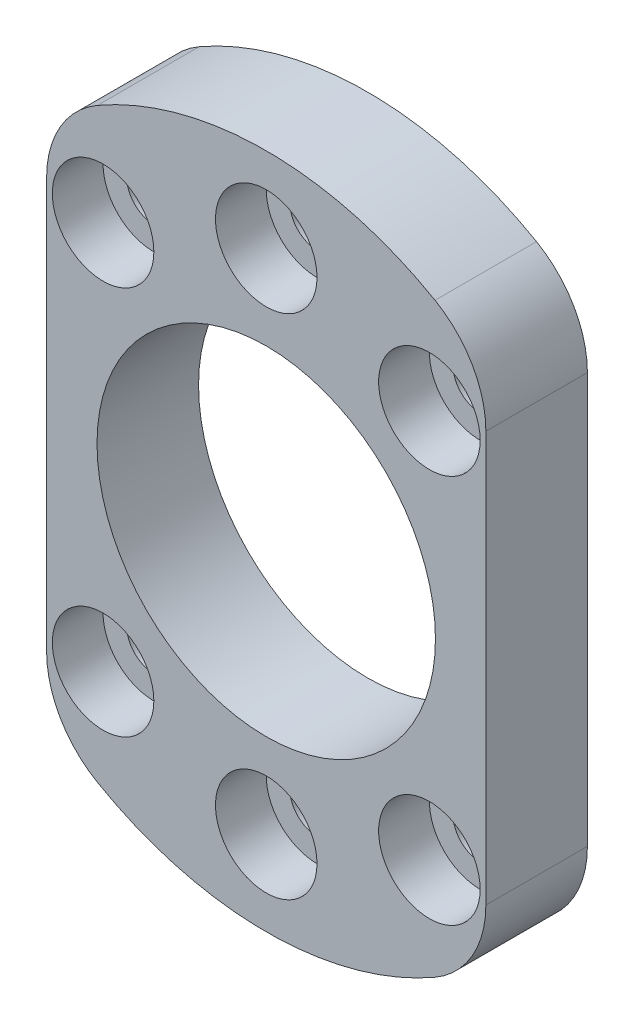
from build123d import *

# Parameters (mm, degrees)
SKETCH_1_R          = 10
EXTRUDE_1_DEPTH     = 6
SKETCH_2_R          = 1.6
CUT_EXTRUDE_1_DEPTH = 7
FILLET_1_R          = 6
FILLET_2_R          = 6
FILLET_3_R          = 6
FILLET_4_R          = 6
SKETCH_3_R          = 3
CUT_EXTRUDE_2_DEPTH = 3


with BuildPart() as part:
    # 草图1 → 拉伸1 (new body)
    with BuildSketch(Plane.XY):
        with BuildLine():
            Line((-12.98, 15.202621484), (-12.98, -15.202621484))
            ThreePointArc((-12.98, -15.202621484), (0, -19.99), (12.98, -15.202621484))
            Line((12.98, -15.202621484), (12.98, 15.202621484))
            ThreePointArc((12.98, 15.202621484), (0, 19.99), (-12.98, 15.202621484))
        make_face()
        Circle(SKETCH_1_R, mode=Mode.SUBTRACT)
    extrude(amount=EXTRUDE_1_DEPTH)

    # 草图2 → 切除-拉伸1 (cut)
    with BuildSketch(Plane.XY.offset(6)):
        with Locations((-9.641814145, 11.490666647)):
            Circle(SKETCH_2_R)
        with Locations((0, 15)):
            Circle(SKETCH_2_R)
        with Locations((9.641814145, 11.490666647)):
            Circle(SKETCH_2_R)
        with Locations((-9.641814145, -11.490666647)):
            Circle(SKETCH_2_R)
        with Locations((0, -15)):
            Circle(SKETCH_2_R)
        with Locations((9.641814145, -11.490666647)):
            Circle(SKETCH_2_R)
    extrude(amount=-CUT_EXTRUDE_1_DEPTH, mode=Mode.SUBTRACT)

    # 圆角1
    fillet_1_edges = [part.edges().sort_by_distance(p)[0] for p in [
        (-12.98, 15.202621484, 3),
    ]]
    fillet(fillet_1_edges, radius=FILLET_1_R)

    # 圆角2
    fillet_2_edges = [part.edges().sort_by_distance(p)[0] for p in [
        (12.98, 15.202621484, 3),
    ]]
    fillet(fillet_2_edges, radius=FILLET_2_R)

    # 圆角3
    fillet_3_edges = [part.edges().sort_by_distance(p)[0] for p in [
        (-12.98, -15.202621484, 3),
    ]]
    fillet(fillet_3_edges, radius=FILLET_3_R)

    # 圆角4
    fillet_4_edges = [part.edges().sort_by_distance(p)[0] for p in [
        (12.98, -15.202621484, 3),
    ]]
    fillet(fillet_4_edges, radius=FILLET_4_R)

    # 草图3 → 切除-拉伸2 (cut)
    with BuildSketch(Plane.XY.offset(6)):
        with Locations((-9.641814145, 11.490666647)):
            Circle(SKETCH_3_R)
        with Locations((0, 15)):
            Circle(SKETCH_3_R)
        with Locations((9.641814145, 11.490666647)):
            Circle(SKETCH_3_R)
        with Locations((-9.641814145, -11.490666647)):
            Circle(SKETCH_3_R)
        with Locations((0, -15)):
            Circle(SKETCH_3_R)
        with Locations((9.641814145, -11.490666647)):
            Circle(SKETCH_3_R)
    extrude(amount=-CUT_EXTRUDE_2_DEPTH, mode=Mode.SUBTRACT)


solid = part.part
